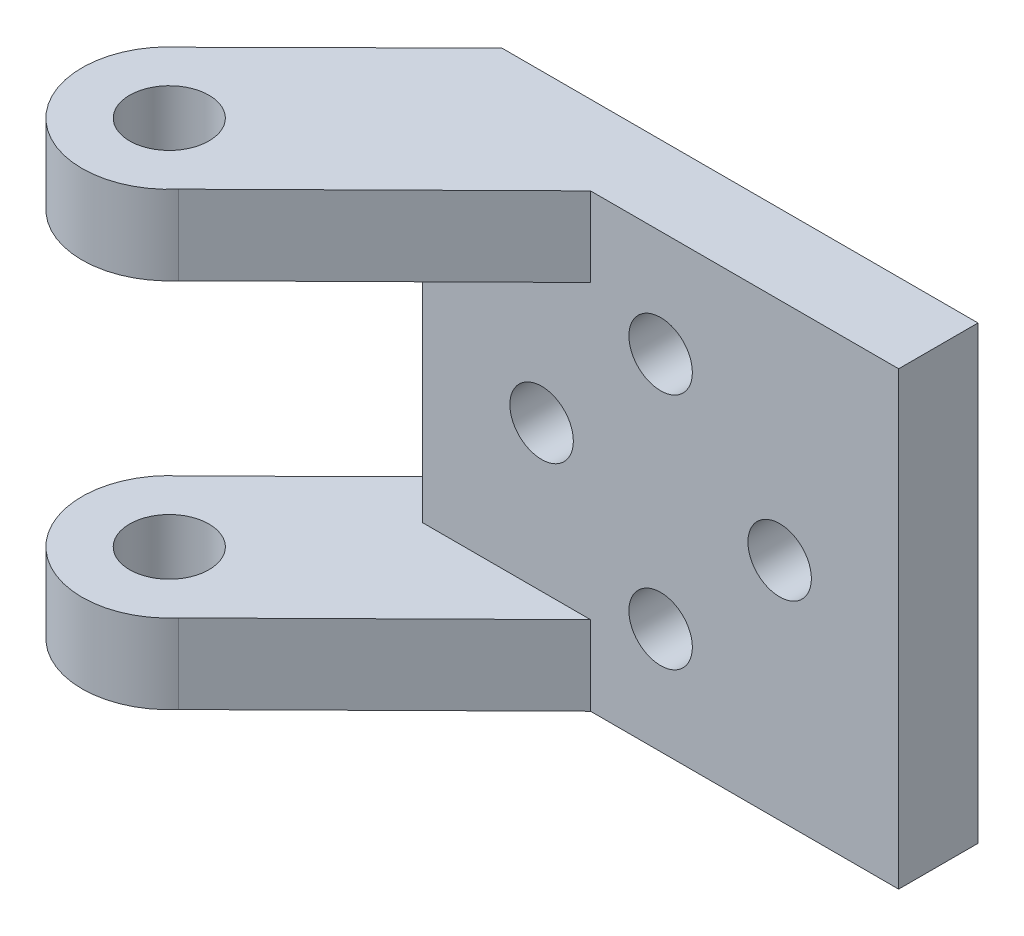
from build123d import *

# Parameters (mm, degrees)
SKETCH2_R           = 4
BOSS_EXTRUDE2_DEPTH = 5
BOSS_EXTRUDE3_DEPTH = 5
SKETCH5_R           = 1.7
CUT_EXTRUDE1_DEPTH  = 39.407684067
BOSS_EXTRUDE4_DEPTH = 5
SKETCH7_R           = 1.7
CUT_EXTRUDE2_DEPTH  = 40.941835153
SKETCH9_W           = 30
SKETCH9_H           = 9.2
BOSS_EXTRUDE5_DEPTH = 5
SKETCH10_W          = 37.796855753
SKETCH10_H          = 5
CUT_EXTRUDE3_DEPTH  = 48.978226264
BOSS_EXTRUDE6_DEPTH = 5
SKETCH13_W          = 14.039948154
SKETCH13_H          = 19.618385366
CUT_EXTRUDE5_DEPTH  = 48.731647734
SKETCH14_R          = 2.5
BOSS_EXTRUDE7_DEPTH = 5
BOSS_EXTRUDE8_START = -5
SKETCH15_R          = 2.5
BOSS_EXTRUDE8_DEPTH = 5
SKETCH17_R          = 2
CUT_EXTRUDE6_DEPTH  = 46.941921982


with BuildPart() as part:
    # Sketch2 → Boss-Extrude2 (new body)
    with BuildSketch(Plane.XZ):
        with Locations(Location((0, 0, 0), (0, 0, 270))):
            Circle(SKETCH2_R)
    extrude(amount=BOSS_EXTRUDE2_DEPTH)

    # Sketch3 → Boss-Extrude3 (add)
    with BuildSketch(Plane.XZ.offset(5)):
        with BuildLine():
            Line((-2.327325083, -0.912993953), (-3.730272393, -1.44397641))
            Line((-3.730272393, -1.44397641), (0, -11.3))
            Line((0, -11.3), (36.661426533, -11.3))
            Line((36.661426533, -11.3), (36.661426533, -6.3))
            Line((36.661426533, -6.3), (6.661426533, -6.3))
            Line((6.661426533, -6.3), (3.751774873, 1.387801954))
            Line((3.751774873, 1.387801954), (2.348616082, 0.856739457))
            ThreePointArc((2.348616082, 0.856739457), (2.461863137, 0.435005629), (2.5, 0))
            ThreePointArc((2.5, 0), (0.464589761, -2.456451985), (-2.327325083, -0.912993953))
        make_face()
    extrude(amount=-BOSS_EXTRUDE3_DEPTH)

    # Sketch5 → Cut-Extrude1 (cut, through all)
    with BuildSketch(Plane.XY.offset(-6.3)):
        with Locations((14.161426533, -2.5)):
            Circle(SKETCH5_R)
        with BuildLine():
            ThreePointArc((30.861426533, -2.5), (29.161426533, -0.8), (27.461426533, -2.5))
            Line((27.461426533, -2.5), (30.861426533, -2.5))
        make_face()
        with BuildLine():
            Line((30.861426533, -2.5), (27.461426533, -2.5))
            ThreePointArc((27.461426533, -2.5), (29.161426533, -4.2), (30.861426533, -2.5))
        make_face()
    extrude(amount=-CUT_EXTRUDE1_DEPTH, mode=Mode.SUBTRACT)

    # Sketch6 → Boss-Extrude4 (add)
    with BuildSketch(Plane.XZ.offset(5)):
        Polygon((-1.13542922, -8.3), (0, -11.3), (36.661426533, -11.3), (36.661426533, -8.3), align=None)
    extrude(amount=BOSS_EXTRUDE4_DEPTH)

    # Sketch7 → Cut-Extrude2 (cut, through all)
    with BuildSketch(Plane.XY.offset(-8.3)):
        with Locations((21.661426533, -7.5)):
            Circle(SKETCH7_R)
    extrude(amount=-CUT_EXTRUDE2_DEPTH, mode=Mode.SUBTRACT)

    # Sketch9 → Boss-Extrude5 (add)
    with BuildSketch(Plane.XY.offset(-6.3)):
        with Locations((21.661426533, 4.6)):
            Rectangle(SKETCH9_W, SKETCH9_H)
    extrude(amount=-BOSS_EXTRUDE5_DEPTH)

    # Mirror1: part across plane


with BuildPart() as part_1:
    add(part.part)
    add(part.part.mirror(Plane(origin=(36.661426533, 9.2, -42.678973852), x_dir=(0, 0, 1), z_dir=(0, 1, 0))))

    # Sketch10 → Cut-Extrude3 (cut, through all)
    with BuildSketch(Plane.XY.offset(-8.3)):
        with Locations((17.762998657, 25.9)):
            Rectangle(SKETCH10_W, SKETCH10_H)
        with Locations((17.762998657, -7.5)):
            Rectangle(SKETCH10_W, SKETCH10_H)
    extrude(amount=-CUT_EXTRUDE3_DEPTH, mode=Mode.SUBTRACT)

    # Sketch11 → Boss-Extrude6 (add)
    with BuildSketch(Plane.XY.offset(-6.3)):
        Polygon((6.661426533, -5), (36.661426533, -5), (36.661426533, 23.4), (6.661426533, 23.4), (6.661426533, 18.4), (6.661426533, 0), align=None)
    extrude(amount=-BOSS_EXTRUDE6_DEPTH)

    # Sketch13 → Cut-Extrude5 (cut, through all)
    with BuildSketch(Plane.XZ.offset(5)):
        with Locations((-0.358547544, -1.490807317)):
            Rectangle(SKETCH13_W, SKETCH13_H)
    extrude(amount=-CUT_EXTRUDE5_DEPTH, mode=Mode.SUBTRACT)

    # Sketch14 → Boss-Extrude7 (add)
    with BuildSketch(Plane.XZ.offset(5)):
        with BuildLine():
            Line((-3.460608767, -1.274831805), (6.661426533, -11.3))
            Line((6.661426533, -11.3), (6.661426533, -6.3))
            Line((6.661426533, -6.3), (17.244800203, -6.3))
            Line((17.244800203, -6.3), (4.175245257, 6.580129473))
            ThreePointArc((4.175245257, 6.580129473), (-3.943701371, 6.83369528), (-3.460608767, -1.274831805))
        make_face()
        with Locations(Location((0, 3, 0), (0, 0, 270))):
            Circle(SKETCH14_R, mode=Mode.SUBTRACT)
    extrude(amount=-BOSS_EXTRUDE7_DEPTH)

    # Sketch15 → Boss-Extrude8 (add)
    with BuildSketch(Plane(origin=(0, 23.4, 0), x_dir=(1, 0, 0), z_dir=(0, 1, 0)).offset(BOSS_EXTRUDE8_START)):
        with BuildLine():
            Line((4.175245257, -6.580129473), (17.244800203, 6.3))
            Line((17.244800203, 6.3), (6.661426533, 6.3))
            Line((6.661426533, 6.3), (6.661426533, 11.3))
            Line((6.661426533, 11.3), (-3.460608767, 1.274831805))
            ThreePointArc((-3.460608767, 1.274831805), (-3.943701371, -6.83369528), (4.175245257, -6.580129473))
        make_face()
        with Locations(Location((0, -3, 0), (0, 0, 90))):
            Circle(SKETCH15_R, mode=Mode.SUBTRACT)
    extrude(amount=BOSS_EXTRUDE8_DEPTH)

    # Sketch17 → Cut-Extrude6 (cut, through all)
    with BuildSketch(Plane.XY.offset(-6.3)):
        with Locations((21.661426533, 1.7)):
            Circle(SKETCH17_R)
        with Locations((21.661426533, 16.7)):
            Circle(SKETCH17_R)
        with Locations((29.161426533, 9.2)):
            Circle(SKETCH17_R)
        with Locations((14.161426533, 9.2)):
            Circle(SKETCH17_R)
    extrude(amount=-CUT_EXTRUDE6_DEPTH, mode=Mode.SUBTRACT)


solid = part_1.part
